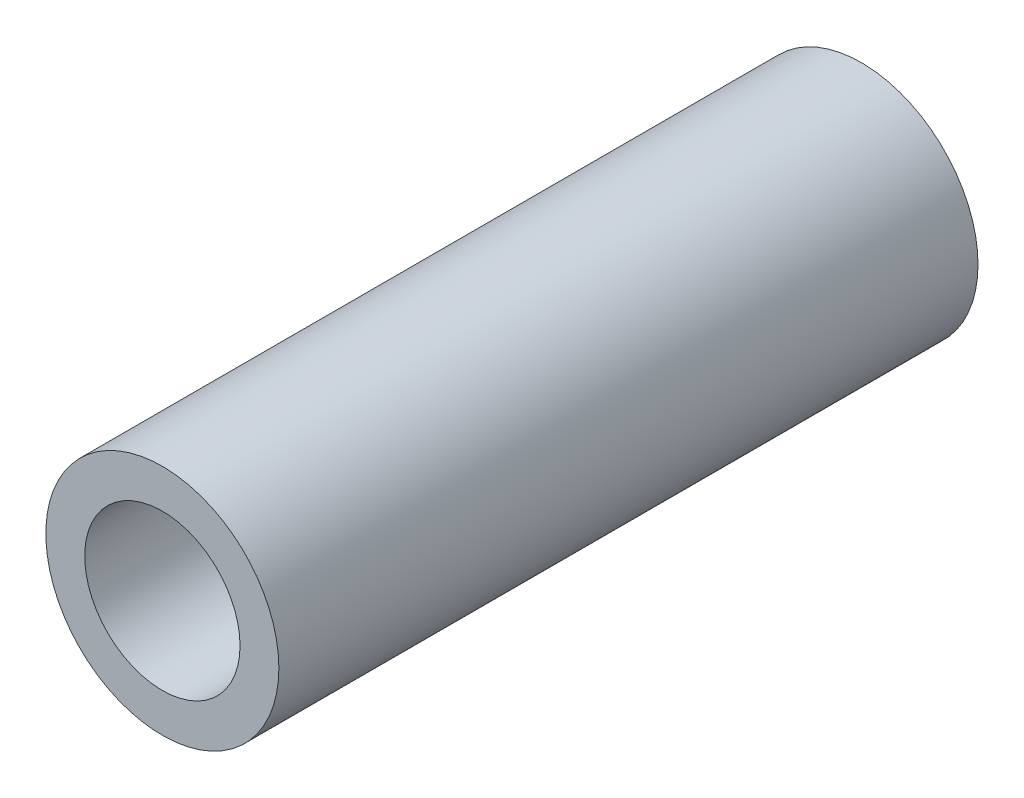
from build123d import *

# Parameters (mm, degrees)
SKETCH_1_R      = 3
SKETCH_1_R_2    = 2
EXTRUDE_1_DEPTH = 18


with BuildPart() as part:
    # 草图1 → 凸台-拉伸1 (new body)
    with BuildSketch(Plane.XY):
        Circle(SKETCH_1_R)
        Circle(SKETCH_1_R_2, mode=Mode.SUBTRACT)
    extrude(amount=EXTRUDE_1_DEPTH)


solid = part.part
